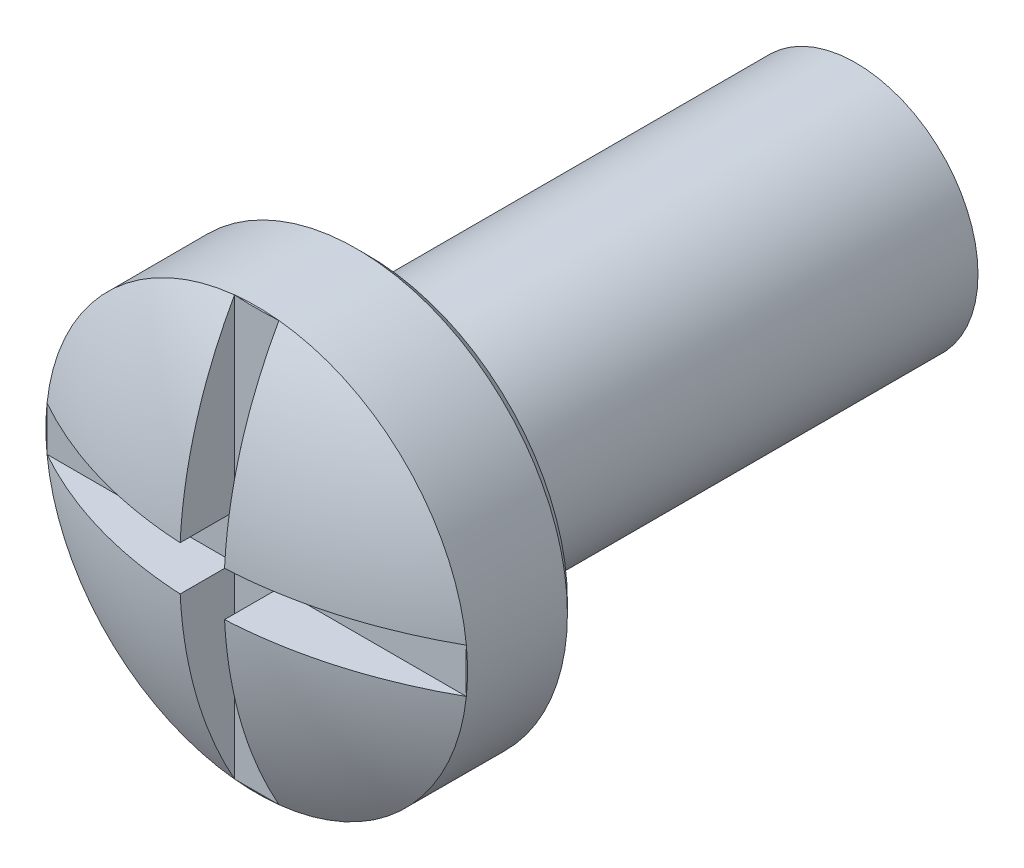
from build123d import *

# Parameters (mm, degrees)
SKETCH1_R           = 9.5
SKETCH1_W           = 2
SKETCH1_H           = 18.894443628
BOSS_EXTRUDE1_DEPTH = 5
SKETCH1_3_R         = 5.5
BOSS_EXTRUDE2_DEPTH = 22
CUT_EXTRUDE2_REACH  = 32.778
CUT_EXTRUDE2_START  = 5
SKETCH1_4_W         = 2
SKETCH1_4_H         = 18.894443628
SKETCH1_4_W_2       = 18.894443628
SKETCH1_4_H_2       = 2
CHAMFER1_SIZE       = 0.5
SKETCH7_R           = 3
CUT_EXTRUDE3_DEPTH  = 20


with BuildPart() as part:
    # Sketch1 → Boss-Extrude1 (new body)
    with BuildSketch(Plane.XY):
        Circle(SKETCH1_R)
        Rectangle(SKETCH1_W, SKETCH1_H)
    extrude(amount=BOSS_EXTRUDE1_DEPTH)

    # Sketch1<3> → Boss-Extrude2 (add)
    with BuildSketch(Plane.XY):
        Circle(SKETCH1_3_R)
    extrude(amount=-BOSS_EXTRUDE2_DEPTH)

    # Sketch2 → Revolve1 (revolve)
    with BuildSketch(Plane(origin=(0, 0, 0), x_dir=(0, 0, -1), z_dir=(1, 0, 0))):
        with BuildLine():
            Line((-5, 9.5), (-5, 0))
            Line((-5, 0), (-7.5, 0))
            ThreePointArc((-7.5, 0), (-6.864538569, 4.911720676), (-5, 9.5))
        make_face()
    revolve(axis=Axis((0, 0, 0), (0, 0, 1)))

    # Sketch1<4> → Cut-Extrude2 (cut, up to next)
    with BuildSketch(Plane.XY.offset(CUT_EXTRUDE2_START), mode=Mode.PRIVATE) as cut_extrude2_sk1:
        Rectangle(SKETCH1_4_W, SKETCH1_4_H)
    cut_extrude2_tool1 = extrude(cut_extrude2_sk1.sketch, amount=CUT_EXTRUDE2_REACH, mode=Mode.PRIVATE) & part.part
    # Sketch1<4> → Cut-Extrude2 (cut, up to next)
    with BuildSketch(Plane.XY.offset(CUT_EXTRUDE2_START), mode=Mode.PRIVATE) as cut_extrude2_sk2:
        Rectangle(SKETCH1_4_W_2, SKETCH1_4_H_2)
    cut_extrude2_tool2 = extrude(cut_extrude2_sk2.sketch, amount=CUT_EXTRUDE2_REACH, mode=Mode.PRIVATE) & part.part
    add(cut_extrude2_tool1.solids().sort_by_distance((0, 0, 5))[0], mode=Mode.SUBTRACT)
    add(cut_extrude2_tool2.solids().sort_by_distance((0, 0, 5))[0], mode=Mode.SUBTRACT)

    # Chamfer1
    chamfer1_edges = [part.edges().sort_by_distance(p)[0] for p in [
        (-9.5, 0, 0),
    ]]
    chamfer(chamfer1_edges, length=CHAMFER1_SIZE)

    # Sketch7 → Cut-Extrude3 (cut)
    with BuildSketch(Plane(origin=(0, 0, -22), x_dir=(-1, 0, 0), z_dir=(0, 0, -1))):
        Circle(SKETCH7_R)
    extrude(amount=-CUT_EXTRUDE3_DEPTH, mode=Mode.SUBTRACT)


solid = part.part
